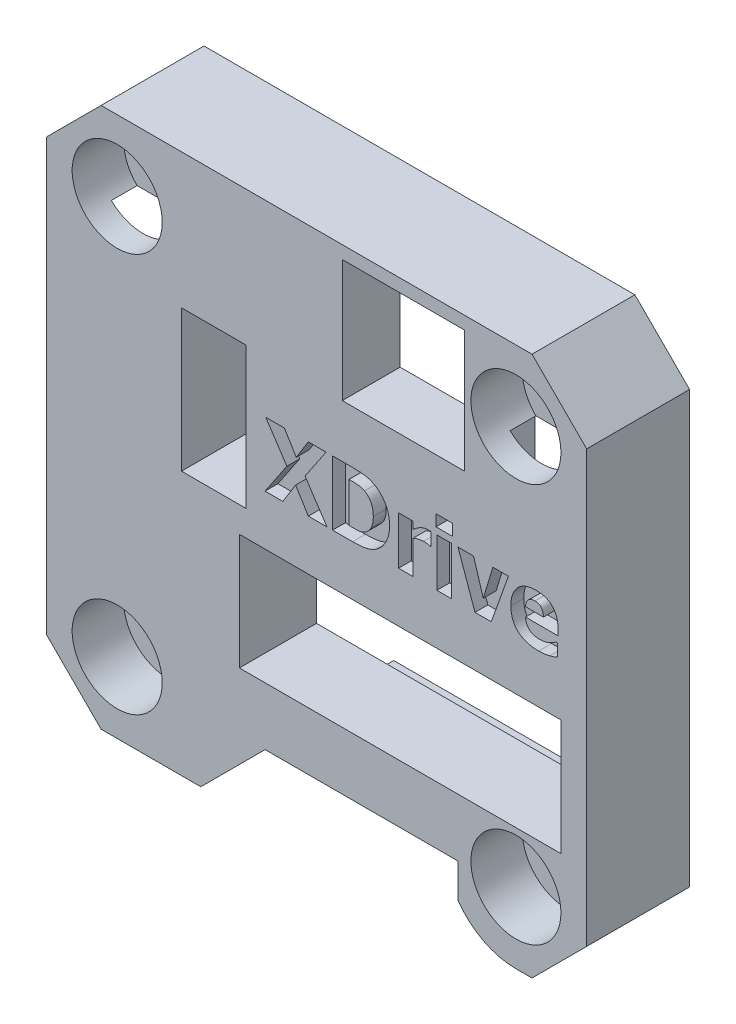
from build123d import *

# Parameters (mm, degrees)
EXTRUDE_1_DEPTH      = 8
SKETCH_5_R           = 3.5
CUT_EXTRUDE_3_DEPTH  = 4
SKETCH_6_R           = 1.6
CUT_EXTRUDE_4_DEPTH  = 30.966648128
SKETCH_2_W           = 9.5
SKETCH_2_H           = 26
CUT_EXTRUDE_1_DEPTH  = 6
SKETCH_4_W           = 5
SKETCH_4_H           = 11
CUT_EXTRUDE_2_DEPTH  = 31.757112998
SKETCH_7_W           = 9.5
SKETCH_7_H           = 9.5
CUT_EXTRUDE_5_DEPTH  = 31.757112998
CUT_EXTRUDE_6_DEPTH  = 31.757112998
SKETCH_9_W           = 10.5
SKETCH_9_H           = 8.5
CUT_EXTRUDE_7_DEPTH  = 3.5
CUT_EXTRUDE_8_DEPTH  = 6
SKETCH_11_W          = 31.5
SKETCH_11_H          = 12.5
CUT_EXTRUDE_9_DEPTH  = 2
SKETCH_14_W          = 1.139240506
SKETCH_14_H          = 3.734177215
SKETCH_14_W_2        = 1.265822784
SKETCH_14_H_2        = 0.88607595
CUT_EXTRUDE_12_DEPTH = 1
SKETCH_13_W          = 25
SKETCH_13_H          = 9
CUT_EXTRUDE_13_DEPTH = 31.298514974
CUT_EXTRUDE_14_DEPTH = 3.5
CUT_EXTRUDE_16_DEPTH = 2


with BuildPart() as part:
    # 草图1 → 凸台-拉伸1 (new body)
    with BuildSketch(Plane.XY):
        Polygon((21, 16.75), (21, -16.75), (16.75, -21), (-16.75, -21), (-21, -16.75), (-21, 16.75), (-16.75, 21), (16.75, 21), align=None)
    extrude(amount=EXTRUDE_1_DEPTH)

    # 草图5 → 切除-拉伸3 (cut)
    with BuildSketch(Plane.XY.offset(8)):
        with Locations((-15.5, 15.5)):
            Circle(SKETCH_5_R)
        with Locations((15.5, 15.5)):
            Circle(SKETCH_5_R)
        with Locations((15.5, -15.5)):
            Circle(SKETCH_5_R)
        with Locations((-15.5, -15.5)):
            Circle(SKETCH_5_R)
    extrude(amount=-CUT_EXTRUDE_3_DEPTH, mode=Mode.SUBTRACT)

    # 草图6 → 切除-拉伸4 (cut, through all)
    with BuildSketch(Plane.XY.offset(4)):
        with Locations((-15.5, 15.5)):
            Circle(SKETCH_6_R)
        with Locations((15.5, 15.5)):
            Circle(SKETCH_6_R)
        with Locations((15.5, -15.5)):
            Circle(SKETCH_6_R)
        with Locations((-15.5, -15.5)):
            Circle(SKETCH_6_R)
    extrude(amount=-CUT_EXTRUDE_4_DEPTH, mode=Mode.SUBTRACT)

    # 草图2 → 切除-拉伸1 (cut)
    with BuildSketch(Plane(origin=(0, 0, 0), x_dir=(-1, 0, 0), z_dir=(0, 0, -1))):
        with Locations((16.25, 0)):
            Rectangle(SKETCH_2_W, SKETCH_2_H)
    extrude(amount=-CUT_EXTRUDE_1_DEPTH, mode=Mode.SUBTRACT)

    # 草图4 → 切除-拉伸2 (cut, through all)
    with BuildSketch(Plane(origin=(0, 0, 0), x_dir=(-1, 0, 0), z_dir=(0, 0, -1))):
        with Locations((8, 5)):
            Rectangle(SKETCH_4_W, SKETCH_4_H)
    extrude(amount=-CUT_EXTRUDE_2_DEPTH, mode=Mode.SUBTRACT)

    # 草图7 → 切除-拉伸5 (cut, through all)
    with BuildSketch(Plane(origin=(0, 0, 0), x_dir=(-1, 0, 0), z_dir=(0, 0, -1))):
        with Locations((-6.75, 15.25)):
            Rectangle(SKETCH_7_W, SKETCH_7_H)
    extrude(amount=-CUT_EXTRUDE_5_DEPTH, mode=Mode.SUBTRACT)

    # 草图8 → 切除-拉伸6 (cut, through all)
    with BuildSketch(Plane(origin=(0, 0, 0), x_dir=(-1, 0, 0), z_dir=(0, 0, -1))):
        with BuildLine():
            Line((-11, -18.66227766), (-11, -16))
            Line((-11, -16), (4, -16))
            Line((4, -16), (9, -21))
            Line((9, -21), (-15.5, -21))
            ThreePointArc((-15.5, -21), (-12.964504696, -20.380703184), (-11, -18.66227766))
        make_face()
    extrude(amount=-CUT_EXTRUDE_6_DEPTH, mode=Mode.SUBTRACT)

    # 草图9 → 切除-拉伸7 (cut)
    with BuildSketch(Plane(origin=(0, 0, 0), x_dir=(-1, 0, 0), z_dir=(0, 0, -1))):
        with Locations((7.25, -16.75)):
            Rectangle(SKETCH_9_W, SKETCH_9_H)
    extrude(amount=-CUT_EXTRUDE_7_DEPTH, mode=Mode.SUBTRACT)

    # 草图10 → 切除-拉伸8 (cut)
    with BuildSketch(Plane(origin=(0, 0, 0), x_dir=(-1, 0, 0), z_dir=(0, 0, -1))):
        Polygon((-20, 13), (-20, -0.5), (4.5, -0.5), (4.5, 11.5), (10.5, 11.5), (10.5, 20), (-1, 20), (-1, 9.5), (-12.5, 9.5), (-12.5, 13), align=None)
    extrude(amount=-CUT_EXTRUDE_8_DEPTH, mode=Mode.SUBTRACT)

    # 草图11 → 切除-拉伸9 (cut)
    with BuildSketch(Plane(origin=(0, 0, 0), x_dir=(-1, 0, 0), z_dir=(0, 0, -1))):
        with Locations((-4.25, -6.75)):
            Rectangle(SKETCH_11_W, SKETCH_11_H)
    extrude(amount=-CUT_EXTRUDE_9_DEPTH, mode=Mode.SUBTRACT)

    # 草图14 → 切除-拉伸12 (cut)
    # profile 1 of 7: a face of its own
    with BuildSketch(Plane.XY.offset(8)):
        Polygon((0.804326975, 1.40223192), (-0.641479987, 1.40223192), (-1.623481569, 3.003299958), (-2.624272708, 1.40223192), (-4.005799607, 1.40223192), (-2.307817012, 3.924977173), (-3.942508468, 6.40223192), (-2.49769043, 6.40223192), (-1.577991063, 4.895111667), (-0.640491063, 6.40223192), (0.741035836, 6.40223192), (-0.89365562, 3.974423376), align=None)
    # profile 2 of 7: a face of its own
    with BuildSketch(Plane.XY.offset(8)):
        with BuildLine():
            add(Edge.make_bspline(
                [(5.677744697, 3.8972873), (5.676724251, 3.839903315), (5.674703854, 3.726287934), (5.660751832, 3.558167263), (5.637261478, 3.394615023), (5.603118377, 3.235927768), (5.561181097, 3.081381315), (5.508036819, 2.931742507), (5.447283708, 2.785946974), (5.375586687, 2.646228849), (5.298249165, 2.512368918), (5.214478389, 2.386292258), (5.127018041, 2.26757072), (5.033676068, 2.157056644), (4.934548224, 2.055691384), (4.831844352, 1.96070977), (4.722556915, 1.875875646), (4.646579495, 1.824428188), (4.608717798, 1.798790465)],
                knots=[0, 0, 0, 0, 1.121822389, 2.221112362, 3.295660391, 4.349819622, 5.392669781, 6.424006338, 7.452176772, 8.478224285, 9.491830202, 10.473124269, 11.435960549, 12.37335562, 13.298531032, 14.206304325, 15.106150719, 16, 16, 16, 16], degree=3))
            add(Edge.make_bspline(
                [(4.608717798, 1.798790465), (4.543603523, 1.759037361), (4.414321612, 1.680109089), (4.206323683, 1.588746625), (3.990942998, 1.51730591), (3.765867844, 1.47137141), (3.534260026, 1.441411), (3.295835216, 1.417880104), (3.050303485, 1.405598119), (2.884045671, 1.403362423), (2.79997571, 1.40223192)],
                knots=[0, 0, 0, 0, 0.973457821, 1.932763407, 2.894071884, 3.866837462, 4.861230705, 5.876345917, 6.926152624, 8, 8, 8, 8], degree=3))
            Line((2.79997571, 1.40223192), (1.24736495, 1.40223192))
            Line((1.24736495, 1.40223192), (1.24736495, 6.40223192))
            Line((1.24736495, 6.40223192), (2.786130773, 6.40223192))
            add(Edge.make_bspline(
                [(2.786130773, 6.40223192), (2.871854873, 6.401582646), (3.040766049, 6.400303314), (3.289787123, 6.386908421), (3.530606704, 6.366272752), (3.763830415, 6.338026902), (3.990773185, 6.293703654), (4.209887626, 6.224293736), (4.421559031, 6.129629725), (4.554422269, 6.049917239), (4.621573811, 6.009629072)],
                knots=[0, 0, 0, 0, 1.079902021, 2.127844083, 3.140779136, 4.124649306, 5.086536717, 6.049284413, 7.014072209, 8, 8, 8, 8], degree=3))
            add(Edge.make_bspline(
                [(4.621573811, 6.009629072), (4.661493271, 5.982776661), (4.74115083, 5.929193833), (4.85420894, 5.839667144), (4.960563159, 5.74285344), (5.061075876, 5.639842069), (5.154055649, 5.52941271), (5.241413699, 5.412840491), (5.321358933, 5.288567986), (5.395683642, 5.158507416), (5.46207483, 5.021404319), (5.52044191, 4.878567411), (5.569146389, 4.729122096), (5.607952132, 4.573974315), (5.640505195, 4.413430071), (5.661207201, 4.246460431), (5.676112911, 4.073916416), (5.677196214, 3.956656683), (5.677744697, 3.8972873)],
                knots=[0, 0, 0, 0, 0.935560749, 1.86687108, 2.801970286, 3.731535202, 4.664191023, 5.608042752, 6.563109811, 7.536574956, 8.520207772, 9.523969371, 10.535788198, 11.574633174, 12.633450416, 13.71986561, 14.845552802, 16, 16, 16, 16], degree=3))
        make_face()
        with BuildLine():
            add(Edge.make_bspline(
                [(4.411921912, 3.905198692), (4.409787968, 3.98407652), (4.405672417, 4.136201294), (4.375453671, 4.356060242), (4.322111896, 4.557483623), (4.260016003, 4.712550142), (4.201019391, 4.827038537), (4.149651041, 4.90634687), (4.094346293, 4.98235031), (4.032356163, 5.053075041), (3.96427751, 5.118483388), (3.892042019, 5.180602003), (3.812946764, 5.236682364), (3.756832945, 5.269965178), (3.728575393, 5.286725591)],
                knots=[0, 0, 0, 0, 1.750384853, 3.375814294, 4.912618378, 6.363557404, 7.073665802, 7.767764976, 8.458424072, 9.158359342, 9.851648351, 10.552347909, 11.270997694, 12, 12, 12, 12], degree=3))
            add(Edge.make_bspline(
                [(3.728575393, 5.286725591), (3.686562663, 5.308670365), (3.603365857, 5.352127076), (3.470692945, 5.396157168), (3.336158761, 5.42874111), (3.196066927, 5.440397414), (3.048882791, 5.4449328), (2.890005986, 5.450867599), (2.717566271, 5.451930774), (2.597904862, 5.452546138), (2.535932988, 5.452864832)],
                knots=[0, 0, 0, 0, 0.931672598, 1.844969007, 2.743879701, 3.650511313, 4.605290892, 5.644149072, 6.779919967, 8, 8, 8, 8], degree=3))
            Line((2.535932988, 5.452864832), (2.513187735, 5.452864832))
            Line((2.513187735, 5.452864832), (2.513187735, 2.351599009))
            Line((2.513187735, 2.351599009), (2.535932988, 2.351599009))
            add(Edge.make_bspline(
                [(2.535932988, 2.351599009), (2.602852266, 2.351744955), (2.731423581, 2.35202536), (2.916017361, 2.355349179), (3.084186679, 2.358922936), (3.238389526, 2.364657766), (3.383964732, 2.379506564), (3.523269588, 2.416475607), (3.659715767, 2.469544839), (3.744667193, 2.519175318), (3.787910836, 2.544439199)],
                knots=[0, 0, 0, 0, 1.248445623, 2.398625619, 3.444398636, 4.386318194, 5.278054247, 6.167050445, 7.066956017, 8, 8, 8, 8], degree=3))
            add(Edge.make_bspline(
                [(3.787910836, 2.544439199), (3.836797958, 2.57833948), (3.93402721, 2.645762124), (4.060672714, 2.771492453), (4.167980578, 2.915573961), (4.258061414, 3.07717856), (4.326957888, 3.258536087), (4.3769733, 3.457597023), (4.406806124, 3.675530655), (4.410172197, 3.826647045), (4.411921912, 3.905198692)],
                knots=[0, 0, 0, 0, 0.910460996, 1.810772236, 2.720195286, 3.656503622, 4.636985059, 5.684687075, 6.796479684, 8, 8, 8, 8], degree=3))
        make_face(mode=Mode.SUBTRACT)
    # profile 3 of 7: a face of its own
    with BuildSketch(Plane.XY.offset(8)):
        with BuildLine():
            Line((8.905592798, 4.123750908), (8.805711469, 4.123750908))
            add(Edge.make_bspline(
                [(8.805711469, 4.123750908), (8.792947453, 4.128963795), (8.765287387, 4.140260304), (8.718708458, 4.152352378), (8.664605099, 4.163442195), (8.58019882, 4.174900124), (8.463118711, 4.185082538), (8.366656503, 4.186369038), (8.316194064, 4.187042047)],
                knots=[0, 0, 0, 0, 0.499555835, 1.082554878, 1.741401483, 2.502234635, 4.170208035, 6, 6, 6, 6], degree=3))
            add(Edge.make_bspline(
                [(8.316194064, 4.187042047), (8.284182145, 4.186627098), (8.218985053, 4.185781993), (8.120373702, 4.173615472), (8.019040458, 4.157715531), (7.882740288, 4.123249109), (7.712565256, 4.073905739), (7.579507464, 4.024673919), (7.513187735, 4.000135401)],
                knots=[0, 0, 0, 0, 0.694620594, 1.414699393, 2.154846584, 2.920443728, 4.465062935, 6, 6, 6, 6], degree=3))
            Line((7.513187735, 4.000135401), (7.513187735, 1.40223192))
            Line((7.513187735, 1.40223192), (6.373947229, 1.40223192))
            Line((6.373947229, 1.40223192), (6.373947229, 5.136409135))
            Line((6.373947229, 5.136409135), (7.513187735, 5.136409135))
            Line((7.513187735, 5.136409135), (7.513187735, 4.589534135))
            add(Edge.make_bspline(
                [(7.513187735, 4.589534135), (7.528352736, 4.602386839), (7.561193503, 4.63022018), (7.613717374, 4.674838533), (7.676175466, 4.7218734), (7.764647813, 4.79121722), (7.874971146, 4.871080811), (7.967048903, 4.925381586), (8.009627608, 4.950491414)],
                knots=[0, 0, 0, 0, 0.582151028, 1.260684763, 2.017571591, 2.870978772, 4.553074317, 6, 6, 6, 6], degree=3))
            add(Edge.make_bspline(
                [(8.009627608, 4.950491414), (8.056201383, 4.975493493), (8.153848381, 5.027913077), (8.287286784, 5.073239463), (8.398344966, 5.106841367), (8.482249463, 5.12294891), (8.563395698, 5.135161075), (8.617111767, 5.135997704), (8.643527925, 5.136409135)],
                knots=[0, 0, 0, 0, 1.423796647, 2.985144929, 3.790145571, 4.552302052, 5.288060019, 6, 6, 6, 6], degree=3))
            add(Edge.make_bspline(
                [(8.643527925, 5.136409135), (8.664295745, 5.13611776), (8.70781596, 5.135507164), (8.774437891, 5.13380052), (8.841037746, 5.129921938), (8.884831776, 5.12627223), (8.905592798, 5.124542047)],
                knots=[0, 0, 0, 0, 0.949811551, 1.99038717, 3.047321808, 4, 4, 4, 4], degree=3))
            Line((8.905592798, 5.124542047), (8.905592798, 4.123750908))
        make_face()
    # profile 4 of 7: a face of its own
    with BuildSketch(Plane.XY.offset(8)):
        with Locations((9.918251026, 3.269320528)):
            Rectangle(SKETCH_14_W, SKETCH_14_H)
    # profile 5 of 7: a face of its own
    with BuildSketch(Plane.XY.offset(8)):
        with Locations((9.918251026, 6.085776224)):
            Rectangle(SKETCH_14_W_2, SKETCH_14_H_2)
    # profile 6 of 7: a face of its own
    with BuildSketch(Plane.XY.offset(8)):
        Polygon((14.918251026, 5.136409135), (13.584192482, 1.40223192), (12.318369697, 1.40223192), (10.994200393, 5.136409135), (12.202665583, 5.136409135), (12.962159254, 2.67893287), (13.708796912, 5.136409135), align=None)
    # profile 7 of 7: a face of its own
    with BuildSketch(Plane.XY.offset(8)):
        with BuildLine():
            add(Edge.make_bspline(
                [(17.266945646, 1.275649642), (17.182176477, 1.277110977), (17.017561078, 1.27994878), (16.778392759, 1.303481257), (16.555054361, 1.344391627), (16.346020667, 1.398758185), (16.152659695, 1.471659559), (15.973143083, 1.558062196), (15.810032047, 1.662619585), (15.662873349, 1.782924164), (15.53195315, 1.917528306), (15.418272388, 2.066334794), (15.321640135, 2.228432331), (15.243610088, 2.404979518), (15.182182847, 2.594506839), (15.138989653, 2.797638517), (15.113175055, 3.013839295), (15.109836695, 3.162444165), (15.108124444, 3.238663882)],
                knots=[0, 0, 0, 0, 1.224146655, 2.377201437, 3.466045713, 4.500774603, 5.492073458, 6.445967947, 7.37307505, 8.283206247, 9.185521256, 10.078709179, 10.981752378, 11.904558815, 12.860601331, 13.854161264, 14.899395285, 16, 16, 16, 16], degree=3))
            add(Edge.make_bspline(
                [(15.108124444, 3.238663882), (15.109459077, 3.31389709), (15.112059948, 3.460507967), (15.137662468, 3.67448254), (15.177906288, 3.87697813), (15.233639209, 4.068451597), (15.307380264, 4.247549852), (15.39697627, 4.41477908), (15.501984028, 4.571104465), (15.623989308, 4.714424376), (15.759946464, 4.84418339), (15.910301838, 4.956815443), (16.074143203, 5.050857178), (16.249782774, 5.129629554), (16.438918499, 5.189909411), (16.640777586, 5.231778439), (16.855193599, 5.258031274), (17.002495084, 5.261309616), (17.078061153, 5.262991414)],
                knots=[0, 0, 0, 0, 1.128458635, 2.199086195, 3.228316402, 4.223722757, 5.186366683, 6.129081764, 7.066082855, 8.006589347, 8.94775896, 9.880638469, 10.818109444, 11.776856887, 12.763908135, 13.790293729, 14.866414587, 16, 16, 16, 16], degree=3))
            add(Edge.make_bspline(
                [(17.078061153, 5.262991414), (17.146684696, 5.261819892), (17.279686678, 5.259549318), (17.472649465, 5.237574267), (17.652241102, 5.20092555), (17.81964819, 5.151588889), (17.972434267, 5.084141186), (18.113872952, 5.00538452), (18.240739175, 4.909728375), (18.354539311, 4.800022534), (18.454283247, 4.676626996), (18.54228677, 4.541445805), (18.614984293, 4.392976428), (18.676112506, 4.232634624), (18.721607777, 4.059078955), (18.75541318, 3.873331842), (18.774996105, 3.675198664), (18.777648586, 3.539010083), (18.77901052, 3.469083186)],
                knots=[0, 0, 0, 0, 1.165526581, 2.258952831, 3.293573605, 4.276825048, 5.217362517, 6.125254107, 7.021305734, 7.908493006, 8.804142019, 9.711325148, 10.643017557, 11.607216833, 12.622003954, 13.686433639, 14.812084564, 16, 16, 16, 16], degree=3))
            Line((18.77901052, 3.469083186), (18.77901052, 3.047801541))
            Line((18.77901052, 3.047801541), (16.24736495, 3.047801541))
            add(Edge.make_bspline(
                [(16.24736495, 3.047801541), (16.250815229, 3.004185756), (16.257469395, 2.920068899), (16.280534433, 2.800258438), (16.311890498, 2.690995601), (16.353294814, 2.59262657), (16.404262577, 2.505117355), (16.462107114, 2.427009643), (16.527144097, 2.357951898), (16.576789579, 2.319984849), (16.60139976, 2.301163882)],
                knots=[0, 0, 0, 0, 1.22642931, 2.365276253, 3.415668661, 4.410032651, 5.350487212, 6.24924468, 7.132118314, 8, 8, 8, 8], degree=3))
            add(Edge.make_bspline(
                [(16.60139976, 2.301163882), (16.626723377, 2.283700548), (16.677931518, 2.248387073), (16.762694981, 2.207014844), (16.852230524, 2.170398391), (16.948588581, 2.143414139), (17.050069656, 2.122621864), (17.156586593, 2.109478579), (17.267104488, 2.099986332), (17.342411897, 2.098957269), (17.380671912, 2.098434452)],
                knots=[0, 0, 0, 0, 0.900663516, 1.821276397, 2.758081318, 3.733809102, 4.749727437, 5.792638816, 6.878547616, 8, 8, 8, 8], degree=3))
            add(Edge.make_bspline(
                [(17.380671912, 2.098434452), (17.447427055, 2.100721114), (17.580837822, 2.105291029), (17.77610852, 2.141800967), (17.962068547, 2.193122352), (18.077981312, 2.242560128), (18.134232039, 2.266551541)],
                knots=[0, 0, 0, 0, 1.029412414, 2.057290173, 3.057232041, 4, 4, 4, 4], degree=3))
            add(Edge.make_bspline(
                [(18.134232039, 2.266551541), (18.180361169, 2.288700512), (18.270033827, 2.331756972), (18.394152254, 2.403512209), (18.500797665, 2.473498262), (18.564578675, 2.520472146), (18.593092798, 2.541472427)],
                knots=[0, 0, 0, 0, 1.145399398, 2.22659755, 3.207177546, 4, 4, 4, 4], degree=3))
            Line((18.593092798, 2.541472427), (18.71571938, 2.541472427))
            Line((18.71571938, 2.541472427), (18.71571938, 1.584193946))
            add(Edge.make_bspline(
                [(18.71571938, 1.584193946), (18.670507578, 1.566181168), (18.5842336, 1.531808861), (18.477609128, 1.487456401), (18.391308139, 1.452292462), (18.316015327, 1.43003432), (18.230646799, 1.404412242), (18.169583974, 1.389417237), (18.137198811, 1.381464515)],
                knots=[0, 0, 0, 0, 1.4267845, 2.722615958, 3.386675329, 4.156949179, 5.022523109, 6, 6, 6, 6], degree=3))
            add(Edge.make_bspline(
                [(18.137198811, 1.381464515), (18.074074175, 1.365891083), (17.94664212, 1.334452416), (17.782481609, 1.306054129), (17.643251341, 1.290523103), (17.527496925, 1.281530447), (17.400816658, 1.27696851), (17.312768811, 1.276101082), (17.266945646, 1.275649642)],
                knots=[0, 0, 0, 0, 1.330600765, 2.686133343, 3.405922851, 4.19769706, 5.062018804, 6, 6, 6, 6], degree=3))
        make_face()
        with BuildLine():
            add(Edge.make_bspline(
                [(17.639770013, 3.744004072), (17.636911093, 3.802561692), (17.631512779, 3.913132231), (17.59709817, 4.067279586), (17.547131305, 4.200788337), (17.485693729, 4.293993152), (17.428085893, 4.356252225), (17.379559167, 4.396009523), (17.325135488, 4.428449921), (17.26692466, 4.456818851), (17.202442384, 4.476998505), (17.133478224, 4.493237946), (17.058499197, 4.501865562), (17.006877795, 4.502941051), (16.980157672, 4.503497743)],
                knots=[0, 0, 0, 0, 1.839389305, 3.473198981, 4.942958973, 6.296275095, 6.948605626, 7.603890865, 8.259503582, 8.936062507, 9.633861758, 10.377741212, 11.160291027, 12, 12, 12, 12], degree=3))
            add(Edge.make_bspline(
                [(16.980157672, 4.503497743), (16.952760972, 4.50306043), (16.899424188, 4.502209055), (16.822041926, 4.491793207), (16.749032046, 4.47633986), (16.680815273, 4.453501357), (16.616959696, 4.424503678), (16.557143808, 4.390078377), (16.502304668, 4.348180864), (16.436742393, 4.283096048), (16.364975215, 4.189073505), (16.301370841, 4.056968138), (16.259658049, 3.906498233), (16.249624095, 3.799652055), (16.244398178, 3.744004072)],
                knots=[0, 0, 0, 0, 0.830839597, 1.61750551, 2.365101873, 3.092686355, 3.795576016, 4.490447117, 5.182721099, 5.883043379, 7.289569954, 8.748070438, 10.306319199, 12, 12, 12, 12], degree=3))
            Line((16.244398178, 3.744004072), (17.639770013, 3.744004072))
        make_face(mode=Mode.SUBTRACT)
    extrude(amount=-CUT_EXTRUDE_12_DEPTH, mode=Mode.SUBTRACT)

    # 草图13 → 切除-拉伸13 (cut, through all)
    with BuildSketch(Plane(origin=(0, 0, 2), x_dir=(-1, 0, 0), z_dir=(0, 0, -1))):
        with Locations((-6.5, -7)):
            Rectangle(SKETCH_13_W, SKETCH_13_H)
    extrude(amount=-CUT_EXTRUDE_13_DEPTH, mode=Mode.SUBTRACT)

    # 草图15 → 切除-拉伸14 (cut)
    with BuildSketch(Plane(origin=(0, 0, 0), x_dir=(-1, 0, 0), z_dir=(0, 0, -1))):
        Polygon((-12.5, 13), (-11.5, 13), (-11.5, 10.5), (-2, 10.5), (-2, 20), (-1, 20), (-1, 9.5), (-12.5, 9.5), align=None)
    extrude(amount=-CUT_EXTRUDE_14_DEPTH, mode=Mode.SUBTRACT)

    # 草图16 → 切除-拉伸16 (cut)
    with BuildSketch(Plane(origin=(0, 0, 0), x_dir=(-1, 0, 0), z_dir=(0, 0, -1))):
        Polygon((4.5, -0.5), (5.5, -0.5), (5.5, 10.5), (10.5, 10.5), (10.5, -0.5), (11.5, -0.5), (11.5, 13), (10.5, 13), (10.5, 11.5), (4.5, 11.5), align=None)
    extrude(amount=-CUT_EXTRUDE_16_DEPTH, mode=Mode.SUBTRACT)


solid = part.part
